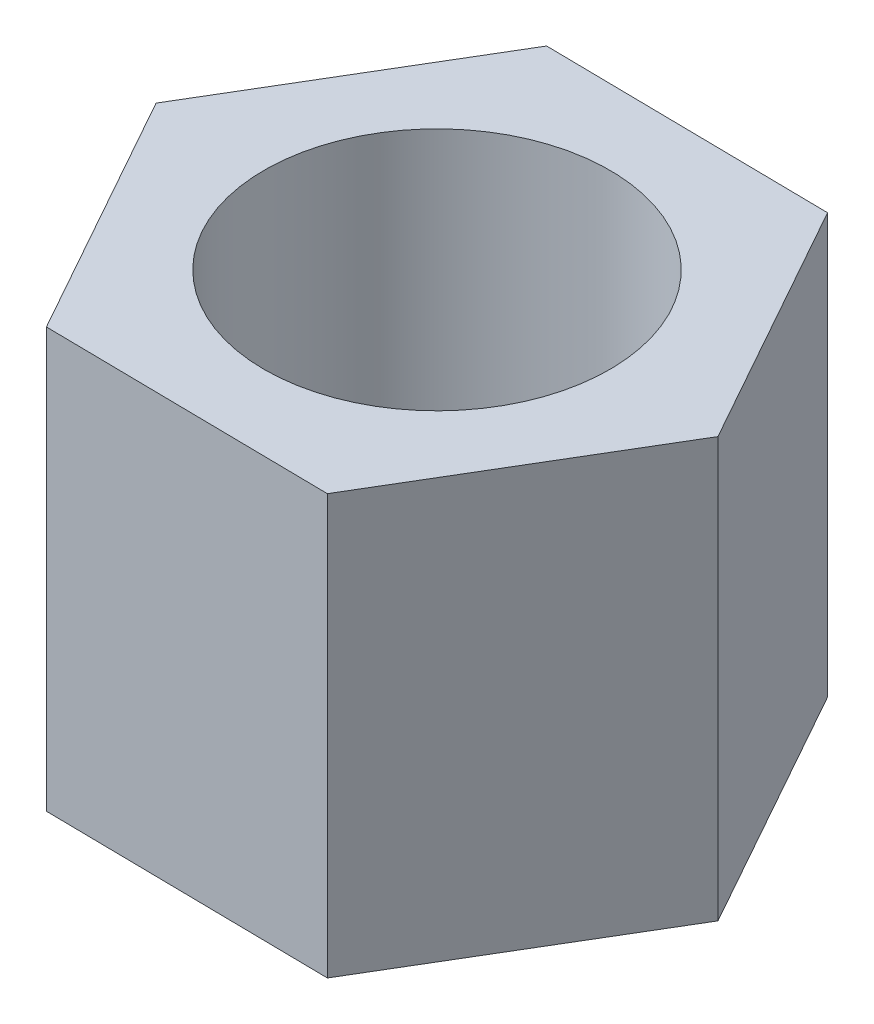
from build123d import *

# Parameters (mm, degrees)
EXTRUDE_1_DEPTH     = 17
SKETCH_2_R          = 7
CUT_EXTRUDE_1_DEPTH = 10


with BuildPart() as part:
    # ｽｹｯﾁ1 → ﾎﾞｽ - 押し出し1 (new body)
    with BuildSketch(Plane(origin=(0, 0, 0), x_dir=(1, 0, 0), z_dir=(0, 1, 0))):
        Polygon((5.635005091, -10.078692919), (11.54590665, -0.1592889), (5.910901559, 9.919404019), (-5.635005091, 10.078692919), (-11.54590665, 0.1592889), (-5.910901559, -9.919404019), align=None)
    extrude(amount=EXTRUDE_1_DEPTH)

    # ｽｹｯﾁ2 → ｶｯﾄ - 押し出し1 (cut)
    with BuildSketch(Plane(origin=(0, 17, 0), x_dir=(1, 0, 0), z_dir=(0, 1, 0))):
        with Locations(Location((0, 0, 0), (0, 0, 270))):
            Circle(SKETCH_2_R)
    extrude(amount=-CUT_EXTRUDE_1_DEPTH, mode=Mode.SUBTRACT)


solid = part.part
